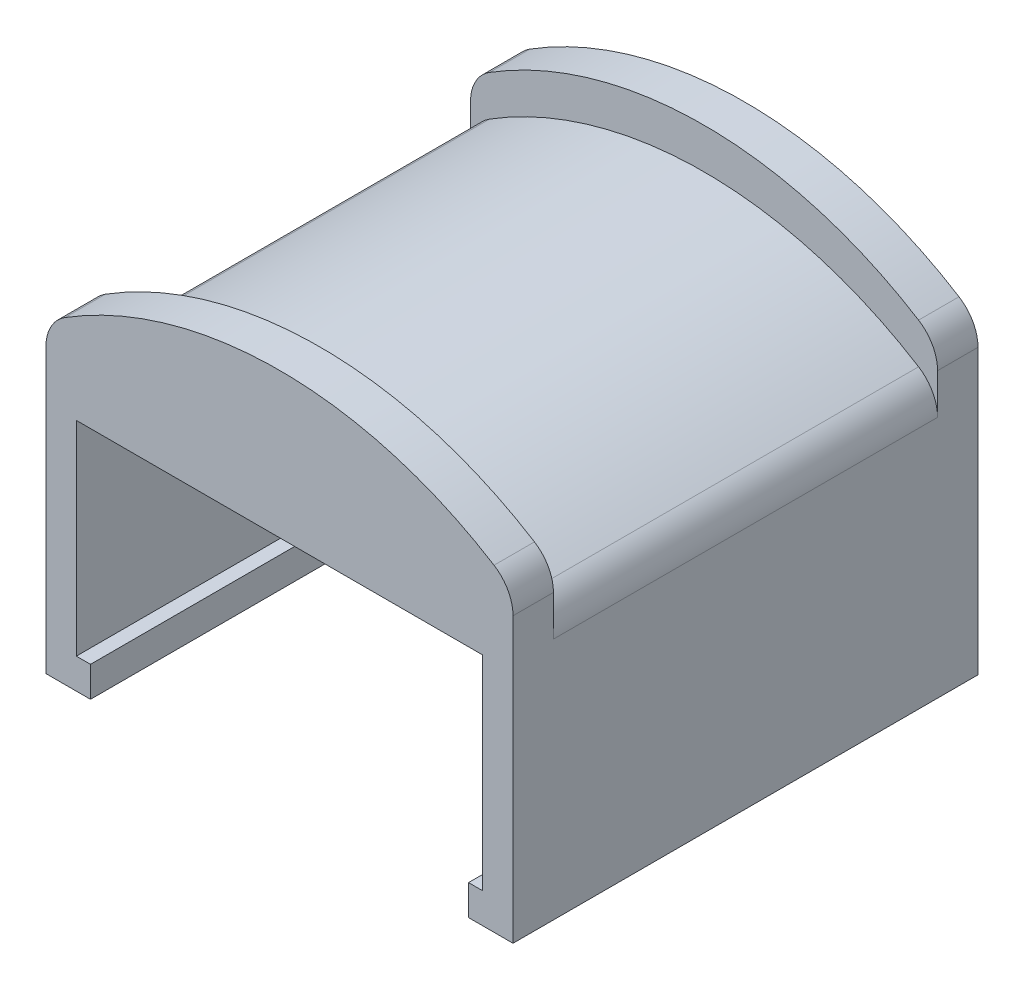
from build123d import *

# Parameters (mm, degrees)
BOSS_EXTRUDE1_DEPTH = 24.13
BOSS_EXTRUDE2_DEPTH = 5.08
LPATTERN1_COUNT     = 2
LPATTERN1_PITCH     = 53.34
FILLET1_R           = 5.08


with BuildPart() as part:
    # Sketch1 → Boss-Extrude1 (new, symmetric)
    with BuildSketch(Plane.XY):
        with BuildLine():
            Line((-25.527, 0), (25.527, 0))
            Line((25.527, 0), (25.527, -25.654))
            Line((25.527, -25.654), (23.749, -25.654))
            Line((23.749, -25.654), (23.749, -29.464))
            Line((23.749, -29.464), (29.337, -29.464))
            Line((29.337, -29.464), (29.337, 3.81))
            ThreePointArc((29.337, 3.81), (0, 13.137353219), (-29.337, 3.81))
            Line((-29.337, 3.81), (-29.337, -29.464))
            Line((-29.337, -29.464), (-23.749, -29.464))
            Line((-23.749, -29.464), (-23.749, -25.654))
            Line((-23.749, -25.654), (-25.527, -25.654))
            Line((-25.527, -25.654), (-25.527, 0))
        make_face()
    extrude(amount=BOSS_EXTRUDE1_DEPTH, both=True)

    # Sketch2 → Boss-Extrude2 (add)
    with BuildSketch(Plane.XY.offset(24.13)):
        with BuildLine():
            Line((29.337, -29.464), (29.337, 8.89))
            ThreePointArc((29.337, 8.89), (0, 18.217353219), (-29.337, 8.89))
            Line((-29.337, 8.89), (-29.337, -29.464))
            Line((-29.337, -29.464), (-23.749, -29.464))
            Line((-23.749, -29.464), (-23.749, -25.654))
            Line((-23.749, -25.654), (-25.527, -25.654))
            Line((-25.527, -25.654), (-25.527, 0))
            Line((-25.527, 0), (25.527, 0))
            Line((25.527, 0), (25.527, -25.654))
            Line((25.527, -25.654), (23.749, -25.654))
            Line((23.749, -25.654), (23.749, -29.464))
            Line((23.749, -29.464), (29.337, -29.464))
        make_face()
    boss_extrude2 = extrude(amount=BOSS_EXTRUDE2_DEPTH)

    # LPattern1: Boss-Extrude2 ×2
    with Locations(*[(0, 0, -i * LPATTERN1_PITCH) for i in range(1, LPATTERN1_COUNT)]):
        add(boss_extrude2)

    # Fillet1
    fillet1_edges = [part.edges().sort_by_distance(p)[0] for p in [
        (-29.337, 3.81, 0),
        (29.337, 3.81, 0),
        (29.337, 8.89, 26.67),
        (-29.337, 8.89, 26.67),
        (29.337, 8.89, -26.67),
        (-29.337, 8.89, -26.67),
    ]]
    fillet(fillet1_edges, radius=FILLET1_R)


solid = part.part
